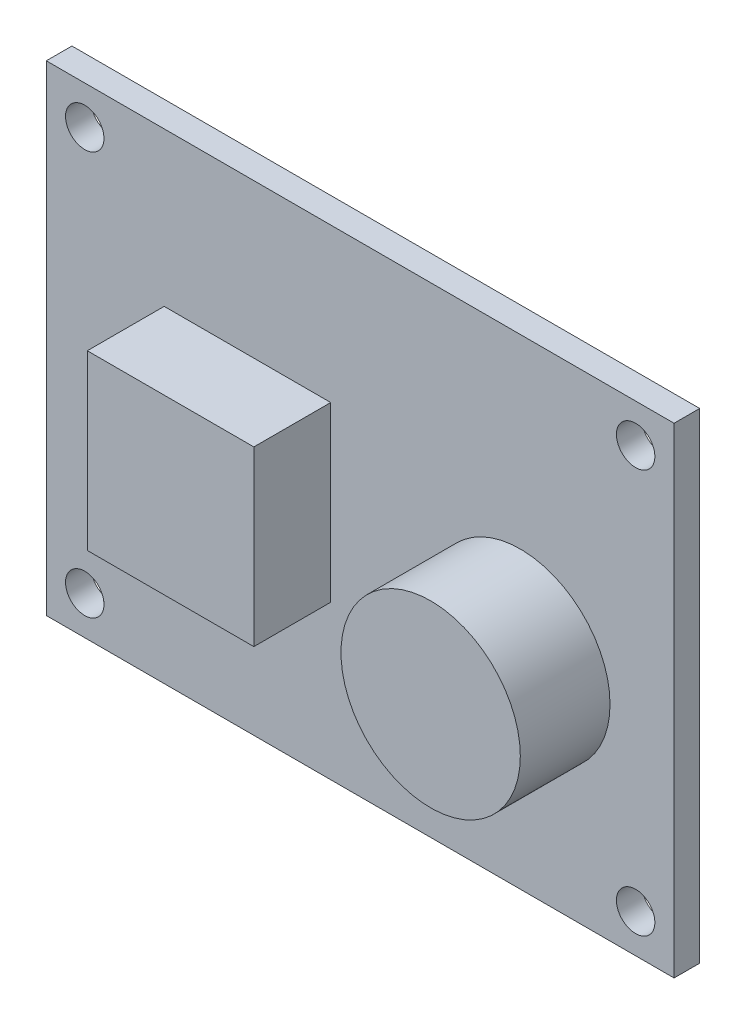
from build123d import *

# Parameters (mm, degrees)
SKETCH_1_W          = 49
SKETCH_1_H          = 37.5
EXTRUDE_1_DEPTH     = 2
SKETCH_2_R          = 1.5
CUT_EXTRUDE_1_DEPTH = 35.450757188
SKETCH_3_R          = 7
EXTRUDE_2_DEPTH     = 7
SKETCH_4_W          = 13
SKETCH_4_H          = 13.5
EXTRUDE_3_DEPTH     = 6


with BuildPart() as part:
    # Эскиз1 → Бобышка-Вытянуть1 (new body)
    with BuildSketch(Plane.XY):
        with Locations((2.388954836, -2.693851768)):
            Rectangle(SKETCH_1_W, SKETCH_1_H)
    extrude(amount=EXTRUDE_1_DEPTH)

    # Эскиз2 → Вырез-Вытянуть1 (cut, through all)
    with BuildSketch(Plane.XY.offset(2)):
        with Locations((-19.111045164, 13.056148232)):
            Circle(SKETCH_2_R)
        with Locations((23.888954836, 13.056148232)):
            Circle(SKETCH_2_R)
        with Locations((23.888954836, -18.443851768)):
            Circle(SKETCH_2_R)
        with Locations((-19.111045164, -18.443851768)):
            Circle(SKETCH_2_R)
    extrude(amount=-CUT_EXTRUDE_1_DEPTH, mode=Mode.SUBTRACT)

    # Эскиз3 → Бобышка-Вытянуть2 (add)
    with BuildSketch(Plane.XY.offset(2)):
        with Locations((14.888954836, -5.443851768)):
            Circle(SKETCH_3_R)
    extrude(amount=EXTRUDE_2_DEPTH)

    # Эскиз4 → Бобышка-Вытянуть3 (add)
    with BuildSketch(Plane.XY.offset(2)):
        with Locations((-6.411045164, -2.693851768)):
            Rectangle(SKETCH_4_W, SKETCH_4_H)
    extrude(amount=EXTRUDE_3_DEPTH)


solid = part.part
